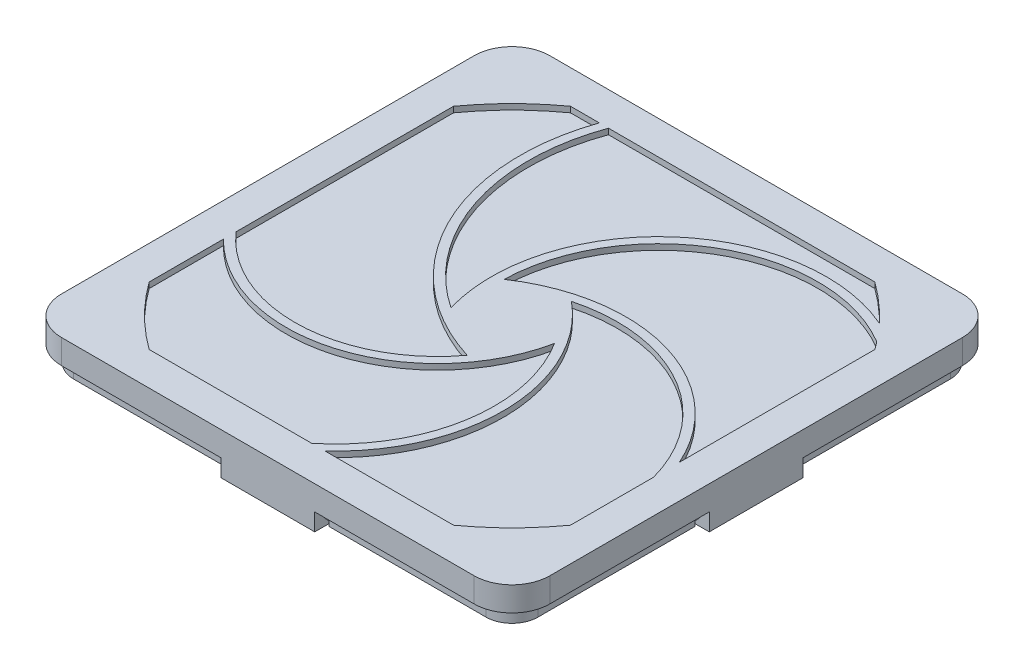
from build123d import *

# Parameters (mm, degrees)
BOSS_EXTRUDE1_DEPTH = 6.2
CUT_EXTRUDE5_DEPTH  = 4.5
BOSS_EXTRUDE7_START = 2
SKETCH13_R          = 2.25
BOSS_EXTRUDE7_DEPTH = 6.9
CUT_EXTRUDE8_DEPTH  = 4.88
BOSS_EXTRUDE6_DEPTH = 11.9
CIRPATTERN3_COUNT   = 4
CUT_EXTRUDE6_DEPTH  = 12.5
CIRPATTERN4_COUNT   = 4
CUT_EXTRUDE4_DEPTH  = 89.319646738
BOSS_EXTRUDE8_START = -0.25
BOSS_EXTRUDE8_DEPTH = 3.3
SKETCH20_W          = 2.3
SKETCH20_H          = 2.02
CHAMFER1_SIZE       = 2


with BuildPart() as part:
    # Sketch2 → Boss-Extrude1 (new body)
    with BuildSketch(Plane(origin=(0, 0, 0), x_dir=(1, 0, 0), z_dir=(0, 1, 0))):
        with BuildLine():
            Line((-52.4, 62), (52.4, 62))
            ThreePointArc((52.4, 62), (59.188225099, 59.188225099), (62, 52.4))
            Line((62, 52.4), (62, -52.4))
            ThreePointArc((62, -52.4), (59.188225099, -59.188225099), (52.4, -62))
            Line((52.4, -62), (-52.4, -62))
            ThreePointArc((-52.4, -62), (-59.188225099, -59.188225099), (-62, -52.4))
            Line((-62, -52.4), (-62, 52.4))
            ThreePointArc((-62, 52.4), (-59.188225099, 59.188225099), (-52.4, 62))
        make_face()
    extrude(amount=BOSS_EXTRUDE1_DEPTH)

    # Sketch11 → Cut-Extrude5 (cut)
    with BuildSketch(Plane.XZ):
        with BuildLine():
            Line((-59.4, 52.4), (-59.4, -52.4))
            ThreePointArc((-59.4, -52.4), (-57.349747468, -57.349747468), (-52.4, -59.4))
            Line((-52.4, -59.4), (52.4, -59.4))
            ThreePointArc((52.4, -59.4), (57.349747468, -57.349747468), (59.4, -52.4))
            Line((59.4, -52.4), (59.4, 52.4))
            ThreePointArc((59.4, 52.4), (57.349747468, 57.349747468), (52.4, 59.4))
            Line((52.4, 59.4), (-52.4, 59.4))
            ThreePointArc((-52.4, 59.4), (-57.349747468, 57.349747468), (-59.4, 52.4))
        make_face()
    extrude(amount=-CUT_EXTRUDE5_DEPTH, mode=Mode.SUBTRACT)

    # Sketch12 → Boss-Extrude6 (add, symmetric)
    with BuildSketch(Plane.XY):
        Polygon((62, -4.4), (57.75, -4.4), (59.4, -2.75), (59.4, 0), (62, 0), align=None)
    boss_extrude6 = extrude(amount=BOSS_EXTRUDE6_DEPTH, both=True)

    # CirPattern3: Boss-Extrude6 ×4 about axis
    cirpattern3_axis = Axis((0, 0, 0), (0, 1, 0))
    for i in range(1, CIRPATTERN3_COUNT):
        add(boss_extrude6.rotate(cirpattern3_axis, i * 360 / CIRPATTERN3_COUNT))


with BuildPart() as body_2:
    # Sketch13 → Boss-Extrude7 (new body)
    with BuildSketch(Plane.XZ.offset(-4.5).offset(BOSS_EXTRUDE7_START)):
        with BuildLine():
            Line((-59, 52.4), (-59, -52.4))
            ThreePointArc((-59, -52.4), (-57.066904756, -57.066904756), (-52.4, -59))
            Line((-52.4, -59), (52.4, -59))
            ThreePointArc((52.4, -59), (57.066904756, -57.066904756), (59, -52.4))
            Line((59, -52.4), (59, 52.4))
            ThreePointArc((59, 52.4), (57.066904756, 57.066904756), (52.4, 59))
            Line((52.4, 59), (-52.4, 59))
            ThreePointArc((-52.4, 59), (-57.066904756, 57.066904756), (-59, 52.4))
        make_face()
        with Locations(Location((-52.4, 52.4, 0), (0, 0, 90))):
            Circle(SKETCH13_R, mode=Mode.SUBTRACT)
        with Locations(Location((52.4, 52.4, 0), (0, 0, 90))):
            Circle(SKETCH13_R, mode=Mode.SUBTRACT)
        with Locations(Location((-52.4, -52.4, 0), (0, 0, 90))):
            Circle(SKETCH13_R, mode=Mode.SUBTRACT)
        with Locations(Location((52.4, -52.4, 0), (0, 0, 90))):
            Circle(SKETCH13_R, mode=Mode.SUBTRACT)
    extrude(amount=BOSS_EXTRUDE7_DEPTH)

    # Sketch17 → Cut-Extrude8 (cut)
    with BuildSketch(Plane.XZ.offset(4.4)):
        with BuildLine():
            Line((56, -47.916418842), (56, 47.916418842))
            ThreePointArc((56, 47.916418842), (48.334136008, 48.334136008), (47.916418842, 56))
            Line((47.916418842, 56), (-47.916418842, 56))
            ThreePointArc((-47.916418842, 56), (-48.334136008, 48.334136008), (-56, 47.916418842))
            Line((-56, 47.916418842), (-56, -47.916418842))
            ThreePointArc((-56, -47.916418842), (-48.334136008, -48.334136008), (-47.916418842, -56))
            Line((-47.916418842, -56), (47.916418842, -56))
            ThreePointArc((47.916418842, -56), (48.334136008, -48.334136008), (56, -47.916418842))
        make_face()
    extrude(amount=-CUT_EXTRUDE8_DEPTH, mode=Mode.SUBTRACT)

    # Sketch14 → Cut-Extrude6 (cut, symmetric)
    with BuildSketch(Plane.XY):
        Polygon((62.25, -4.65), (62.25, 0.25), (59.4, 0.25), (59.4, -2.396446609), (57.146446609, -4.65), align=None)
    cut_extrude6 = extrude(amount=CUT_EXTRUDE6_DEPTH, both=True, mode=Mode.SUBTRACT)

    # CirPattern4: Cut-Extrude6 ×4 about axis
    cirpattern4_axis = Axis((0, 0, 0), (0, 1, 0))
    for i in range(1, CIRPATTERN4_COUNT):
        add(cut_extrude6.rotate(cirpattern4_axis, i * 360 / CIRPATTERN4_COUNT), mode=Mode.SUBTRACT)


with BuildPart() as cut_extrude4_tool:
    # Sketch3 → Cut-Extrude4 (new, through all)
    with BuildSketch(Plane(origin=(0, 6.2, 0), x_dir=(1, 0, 0), z_dir=(0, 1, 0))):
        with BuildLine():
            Line((38.649062084, 53.5), (-29, 53.5))
            ThreePointArc((-29, 53.5), (-29.507032422, 20.388451559), (-9.5, -6))
            ThreePointArc((-9.5, -6), (3.182290493, 37.862762438), (48.280430818, 45))
            ThreePointArc((48.280430818, 45), (43.672035493, 49.48487967), (38.649062084, 53.5))
        make_face()
        with BuildLine():
            Line((-53.5, 38.649062084), (-53.5, -16.560294323))
            ThreePointArc((-53.5, -16.560294323), (-24.729360518, -29.035102079), (3, -14.390885131))
            ThreePointArc((3, -14.390885131), (-28.529505606, 12.29107867), (-31.333381291, 53.5))
            Line((-31.333381291, 53.5), (-38.649062084, 53.5))
            ThreePointArc((-38.649062084, 53.5), (-46.669047558, 46.669047558), (-53.5, 38.649062084))
        make_face()
        with BuildLine():
            ThreePointArc((-9, 7), (26.450940936, 12.586600473), (53.5, -11))
            Line((53.5, -11), (53.5, 38.649062084))
            ThreePointArc((53.5, 38.649062084), (52.770790084, 39.638916659), (52.023268375, 40.615016282))
            ThreePointArc((52.023268375, 40.615016282), (11.872702647, 41.305613789), (-9, 7))
        make_face()
        with BuildLine():
            ThreePointArc((4.4, 10.7), (19.826219728, -21.03548362), (6, -53.5))
            Line((6, -53.5), (38.649062084, -53.5))
            ThreePointArc((38.649062084, -53.5), (46.669047558, -46.669047558), (53.5, -38.649062084))
            Line((53.5, -38.649062084), (53.5, -17.533875256))
            ThreePointArc((53.5, -17.533875256), (34.761505962, 6.689536959), (4.4, 10.7))
        make_face()
        with BuildLine():
            ThreePointArc((-53.5, -38.649062084), (-46.669047558, -46.669047558), (-38.649062084, -53.5))
            Line((-38.649062084, -53.5), (2.625557616, -53.5))
            ThreePointArc((2.625557616, -53.5), (17.081272954, -28.783874036), (11.5, -0.7))
            ThreePointArc((11.5, -0.7), (-15.283892446, -29.702722042), (-53.5, -19.8))
            Line((-53.5, -19.8), (-53.5, -38.649062084))
        make_face()
    extrude(amount=-CUT_EXTRUDE4_DEPTH)


with BuildPart() as part_1:
    add(part.part)

    # Cut-Extrude4: cut by cut_extrude4_tool
    add(cut_extrude4_tool.part, mode=Mode.SUBTRACT)


with BuildPart() as body_2_1:
    add(body_2.part)

    # Cut-Extrude4: cut by cut_extrude4_tool
    add(cut_extrude4_tool.part, mode=Mode.SUBTRACT)

    # Sketch20 → Revolve1 (revolve)
    with BuildSketch(Plane(origin=(0, 0, 0), x_dir=(0, 0, -1), z_dir=(1, 0, 0))):
        with Locations((-57.85, 1.49)):
            Rectangle(SKETCH20_W, SKETCH20_H)
        with Locations((-49.87, 1.49)):
            Rectangle(SKETCH20_W, SKETCH20_H)
        with Locations((-17.95, 1.49)):
            Rectangle(SKETCH20_W, SKETCH20_H)
        with Locations((-33.91, 1.49)):
            Rectangle(SKETCH20_W, SKETCH20_H)
        with Locations((-41.89, 1.49)):
            Rectangle(SKETCH20_W, SKETCH20_H)
        with Locations((-25.93, 1.49)):
            Rectangle(SKETCH20_W, SKETCH20_H)
    revolve(axis=Axis((0, 6.73000125, 0), (0, -1, 0)))

    # Chamfer1
    chamfer1_edges = [body_2_1.edges().sort_by_distance(p)[0] for p in [
        (-52.4, 2.5, 50.15),
        (52.4, 2.5, 50.15),
        (-52.4, 2.5, -54.65),
        (52.4, 2.5, -54.65),
    ]]
    chamfer(chamfer1_edges, length=CHAMFER1_SIZE)


with BuildPart() as body_3:
    # Sketch18 → Boss-Extrude8 (new body)
    with BuildSketch(Plane.XZ.offset(-4.5).offset(BOSS_EXTRUDE8_START)):
        Polygon((-57.9, 47.9), (-47.9, 57.9), (47.9, 57.9), (57.9, 47.9), (57.9, -47.9), (47.9, -57.9), (-47.9, -57.9), (-57.9, -47.9), align=None)
    extrude(amount=BOSS_EXTRUDE8_DEPTH)


solid = Compound([part_1.part, body_2_1.part, body_3.part])
